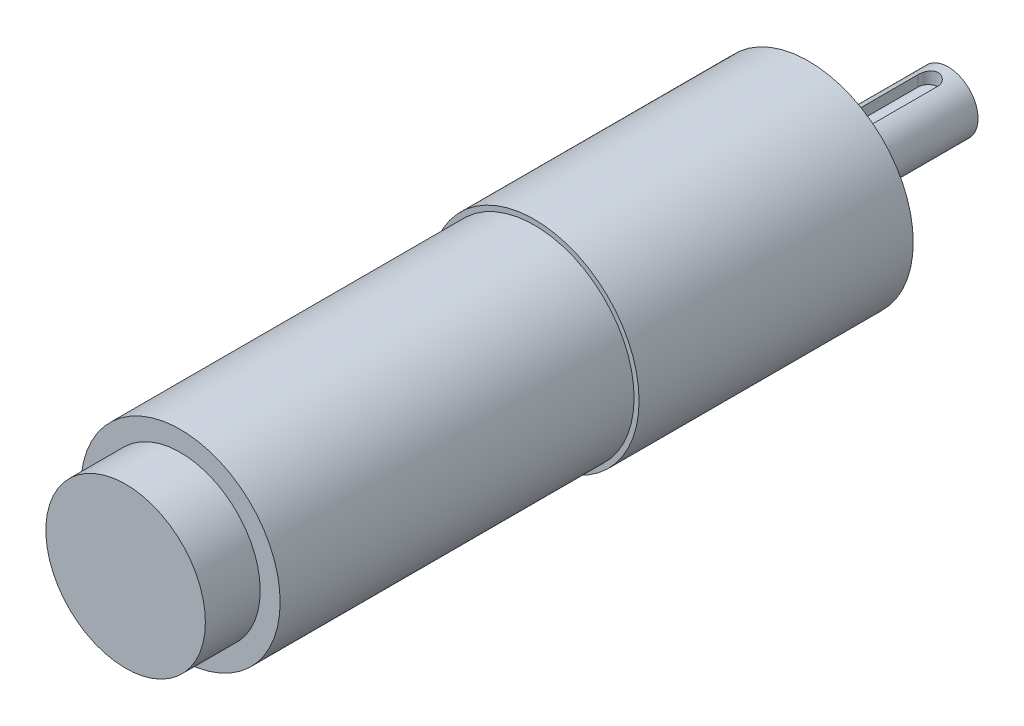
from build123d import *

# Parameters (mm, degrees)
SKETCH_1_R          = 21
EXTRUDE_323_DEPTH   = 55
SKETCH_2_R          = 20
EXTRUDE_422_DEPTH   = 71
SKETCH_3_R          = 16
EXTRUDE_545_DEPTH   = 11
SKETCH_5_R          = 14
EXTRUDE_640_DEPTH   = 3
SKETCH_4_R          = 6
EXTRUDE_761_DEPTH   = 25
CUT_EXTRUDE_1_DEPTH = 2.5


with BuildPart() as part:
    # 草图1 → Extrude 323 (new body)
    with BuildSketch(Plane.XY):
        Circle(SKETCH_1_R)
    extrude(amount=EXTRUDE_323_DEPTH)

    # 草图2 → Extrude 422 (add)
    with BuildSketch(Plane.XY.offset(55)):
        Circle(SKETCH_2_R)
    extrude(amount=EXTRUDE_422_DEPTH)

    # 草图3 → Extrude 545 (add)
    with BuildSketch(Plane.XY.offset(126)):
        Circle(SKETCH_3_R)
    extrude(amount=EXTRUDE_545_DEPTH)

    # 草图5 → Extrude 640 (add)
    with BuildSketch(Plane(origin=(0, 0, 0), x_dir=(-1, 0, 0), z_dir=(0, 0, -1))):
        with Locations(Location((0, 0, 0), (0, 0, 180))):
            Circle(SKETCH_5_R)
    extrude(amount=EXTRUDE_640_DEPTH)


with BuildPart() as body_2:
    # 草图4 → Extrude 761 (new body)
    with BuildSketch(Plane(origin=(0, 0, -3), x_dir=(-1, 0, 0), z_dir=(0, 0, -1))):
        Circle(SKETCH_4_R)
    extrude(amount=EXTRUDE_761_DEPTH)

    # 草图6 → 切除-拉伸1 (cut)
    with BuildSketch(Plane(origin=(0, 6, 0), x_dir=(-1, 0, 0), z_dir=(0, 1, 0))):
        with BuildLine():
            Line((-2, -24), (-2, -8))
            ThreePointArc((-2, -8), (0, -6), (2, -8))
            Line((2, -8), (2, -24))
            ThreePointArc((2, -24), (0, -26), (-2, -24))
        make_face()
    extrude(amount=-CUT_EXTRUDE_1_DEPTH, mode=Mode.SUBTRACT)


solid = Compound([part.part, body_2.part])
